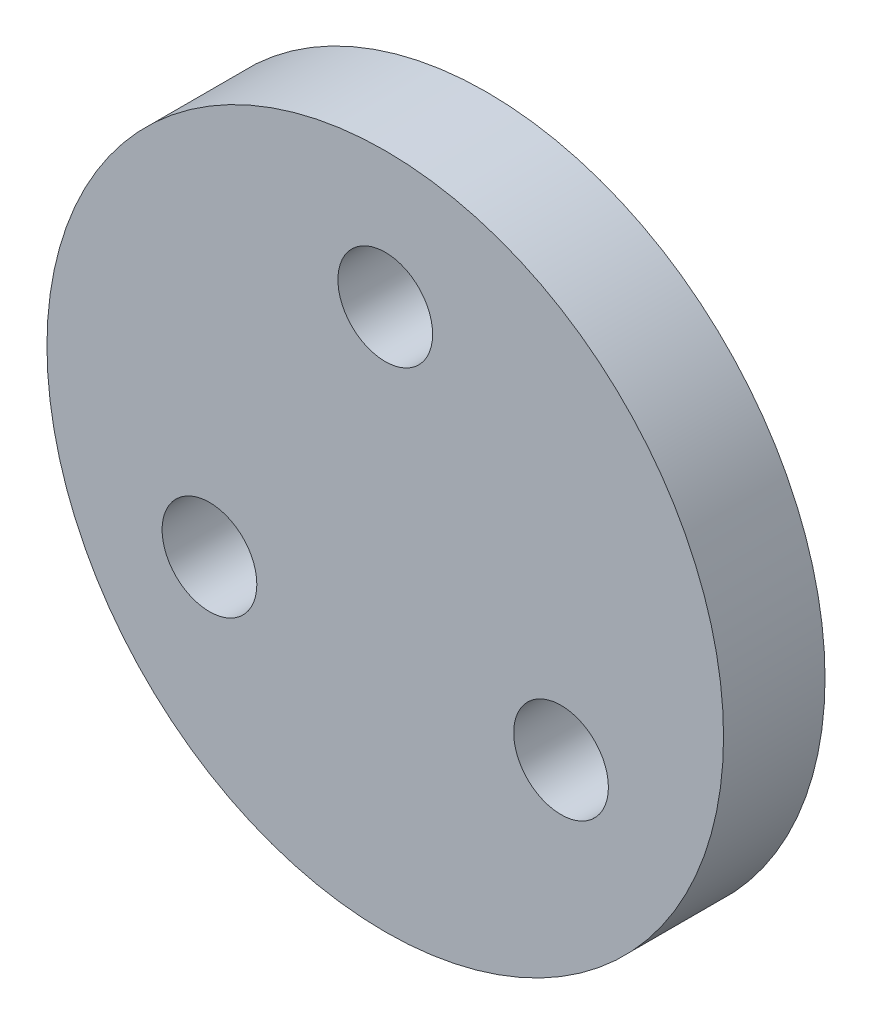
from build123d import *

# Parameters (mm, degrees)
SKETCH1_R           = 3
BOSS_EXTRUDE1_DEPTH = 5
SKETCH2_R           = 10
BOSS_EXTRUDE2_DEPTH = 3
SKETCH3_R           = 1.4
CUT_EXTRUDE1_DEPTH  = 3
CIRPATTERN1_COUNT   = 3
CHAMFER1_SIZE       = 1


with BuildPart() as part:
    # Sketch1 → Boss-Extrude1 (new body)
    with BuildSketch(Plane.XY):
        Circle(SKETCH1_R)
    extrude(amount=BOSS_EXTRUDE1_DEPTH)

    # Sketch2 → Boss-Extrude2 (add)
    with BuildSketch(Plane.XY.offset(5)):
        Circle(SKETCH2_R)
    extrude(amount=BOSS_EXTRUDE2_DEPTH)

    # Sketch3 → Cut-Extrude1 (cut)
    with BuildSketch(Plane.XY.offset(8)):
        with Locations((0, 6)):
            Circle(SKETCH3_R)
    cut_extrude1 = extrude(amount=-CUT_EXTRUDE1_DEPTH, mode=Mode.SUBTRACT)

    # CirPattern1: Cut-Extrude1 ×3 about axis
    cirpattern1_axis = Axis((0, 0, 0), (0, 0, 1))
    for i in range(1, CIRPATTERN1_COUNT):
        add(cut_extrude1.rotate(cirpattern1_axis, i * 360 / CIRPATTERN1_COUNT), mode=Mode.SUBTRACT)

    # Chamfer1
    chamfer1_edges = [part.edges().sort_by_distance(p)[0] for p in [
        (-3, 0, 0),
    ]]
    chamfer(chamfer1_edges, length=CHAMFER1_SIZE)


solid = part.part
